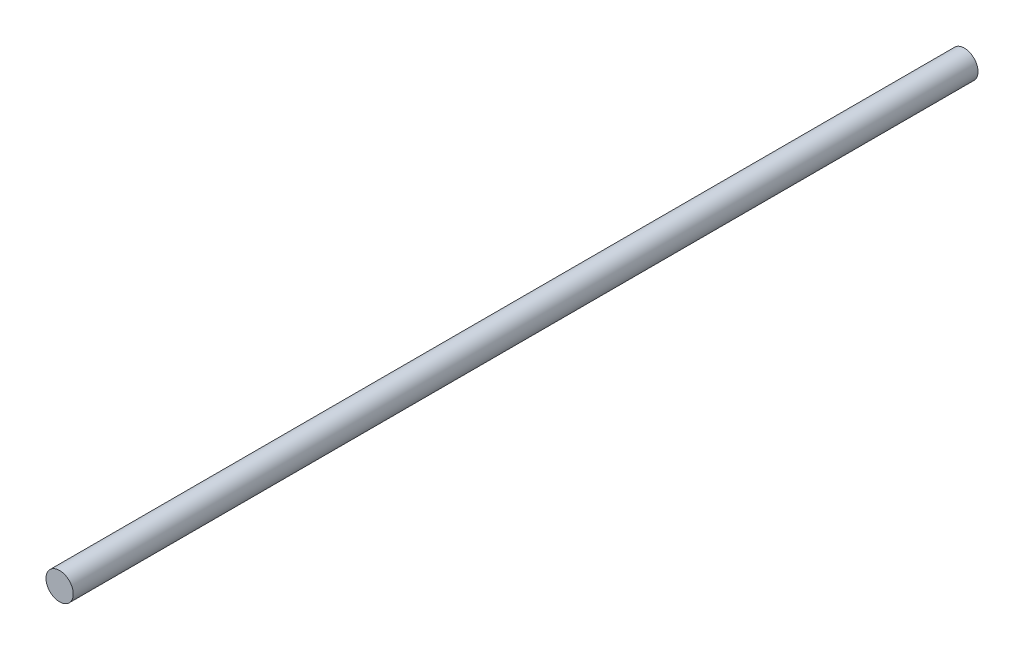
from build123d import *

# Parameters (mm, degrees)
SKETCH1_R           = 6.5
BOSS_EXTRUDE1_DEPTH = 431.8


with BuildPart() as part:
    # Sketch1 → Boss-Extrude1 (new body)
    with BuildSketch(Plane.XY):
        Circle(SKETCH1_R)
    extrude(amount=BOSS_EXTRUDE1_DEPTH)


solid = part.part
